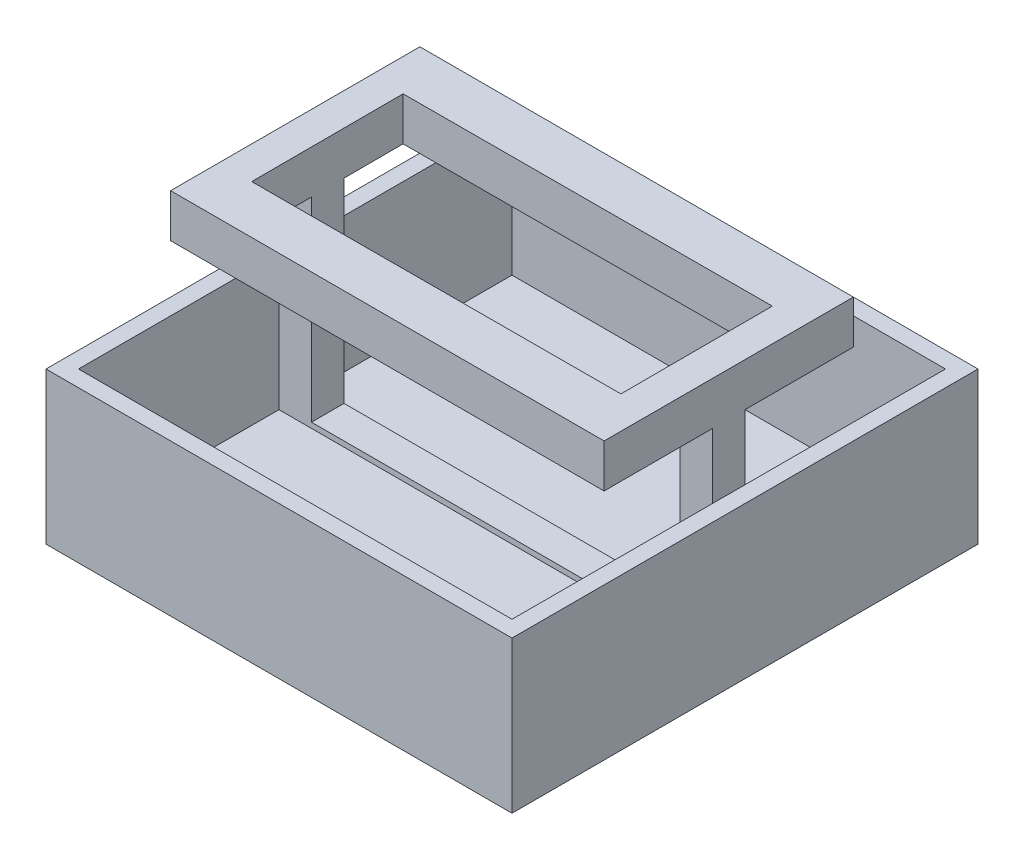
from build123d import *

# Parameters (mm, degrees)
SKETCH1_W                = 21.5
SKETCH1_H                = 21.5
BOSS_EXTRUDE1_DEPTH      = 7
SKETCH1_3_W              = 20
SKETCH1_3_H              = 20
BOSS_EXTRUDE2_DEPTH      = 0.75
SKETCH1_4_W              = 20
SKETCH1_4_H              = 1.5
BOSS_EXTRUDE3_DEPTH      = 12
BOSS_EXTRUDE4_DEPTH      = 5
BOSS_EXTRUDE4_DEPTH_BACK = 6.5
SKETCH3_W                = 20
SKETCH3_H                = 2
CUT_EXTRUDE1_DEPTH       = 11


with BuildPart() as part:
    # Sketch1 → Boss-Extrude1 (new body)
    with BuildSketch(Plane(origin=(0, 0, 0), x_dir=(1, 0, 0), z_dir=(0, 1, 0))):
        Rectangle(SKETCH1_W, SKETCH1_H)
        Polygon((-10, 0.75), (-10, 10), (10, 10), (10, 0.75), (10, -0.75), (10, -10), (-10, -10), (-10, -0.75), align=None, mode=Mode.SUBTRACT)
    extrude(amount=BOSS_EXTRUDE1_DEPTH)

    # Sketch1<3> → Boss-Extrude2 (add)
    with BuildSketch(Plane(origin=(0, 0, 0), x_dir=(1, 0, 0), z_dir=(0, 1, 0))):
        Rectangle(SKETCH1_3_W, SKETCH1_3_H)
    extrude(amount=BOSS_EXTRUDE2_DEPTH)

    # Sketch1<4> → Boss-Extrude3 (add)
    with BuildSketch(Plane(origin=(0, 0, 0), x_dir=(1, 0, 0), z_dir=(0, 1, 0))):
        Rectangle(SKETCH1_4_W, SKETCH1_4_H)
    extrude(amount=BOSS_EXTRUDE3_DEPTH)

    # Sketch3 → Boss-Extrude4 (add, two sides: drawn at the far end of the back side and taken through both)
    with BuildSketch(Plane(origin=(0, 0, -0.75), x_dir=(-1, 0, 0), z_dir=(0, 0, -1)).offset(-BOSS_EXTRUDE4_DEPTH_BACK)):
        with Locations((0, 11)):
            Rectangle(SKETCH3_W, SKETCH3_H)
    extrude(amount=BOSS_EXTRUDE4_DEPTH + BOSS_EXTRUDE4_DEPTH_BACK)

    # Sketch4 → Cut-Extrude1 (cut)
    with BuildSketch(Plane(origin=(0, 12, 0), x_dir=(1, 0, 0), z_dir=(0, 1, 0))):
        Polygon((-8.507158245, 3.482615691), (8.492841755, 3.517384309), (8.507158245, -3.482615691), (-8.492841755, -3.517384309), align=None)
    extrude(amount=-CUT_EXTRUDE1_DEPTH, mode=Mode.SUBTRACT)


solid = part.part
